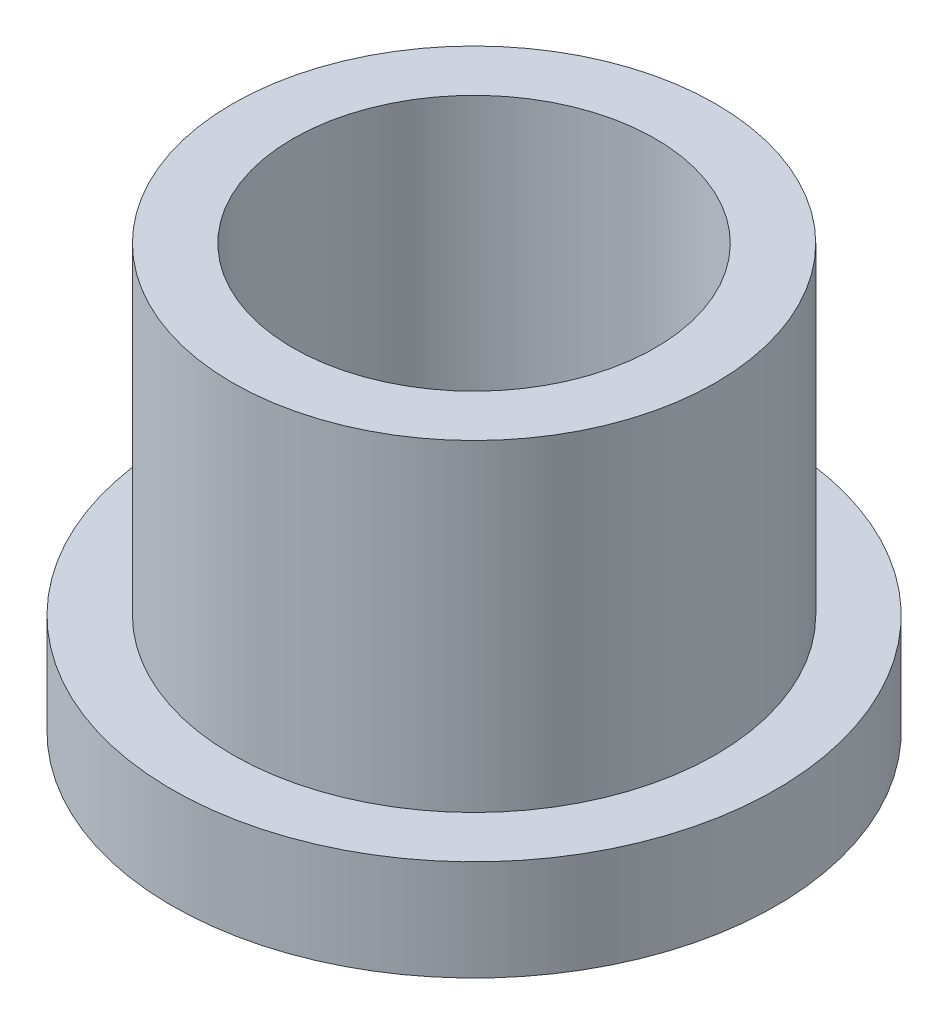
from build123d import *

# Parameters (mm, degrees)
CORTAR_EXTRUIR1_DEPTH      = 40.572717875
CORTAR_EXTRUIR1_DEPTH_BACK = 40.572717875
CROQUIS2_R                 = 9


with BuildPart() as part:
    # Croquis1 → Revolución1 (revolve)
    with BuildSketch(Plane.XY):
        Polygon((0, 0), (0, 5), (3, 5), (3, 21), (15, 21), (15, 0), align=None)
    revolve(axis=Axis((15, 21, 0), (0, -1, 0)))

    # Croquis2 → Cortar-Extruir1 (cut, two sides: drawn at the far end of the back side and taken through both)
    with BuildSketch(Plane(origin=(0, 21, 0), x_dir=(1, 0, 0), z_dir=(0, 1, 0)).offset(-CORTAR_EXTRUIR1_DEPTH_BACK)):
        with Locations(Location((15, 0, 0), (0, 0, 180))):
            Circle(CROQUIS2_R)
    extrude(amount=CORTAR_EXTRUIR1_DEPTH + CORTAR_EXTRUIR1_DEPTH_BACK, mode=Mode.SUBTRACT)


solid = part.part
